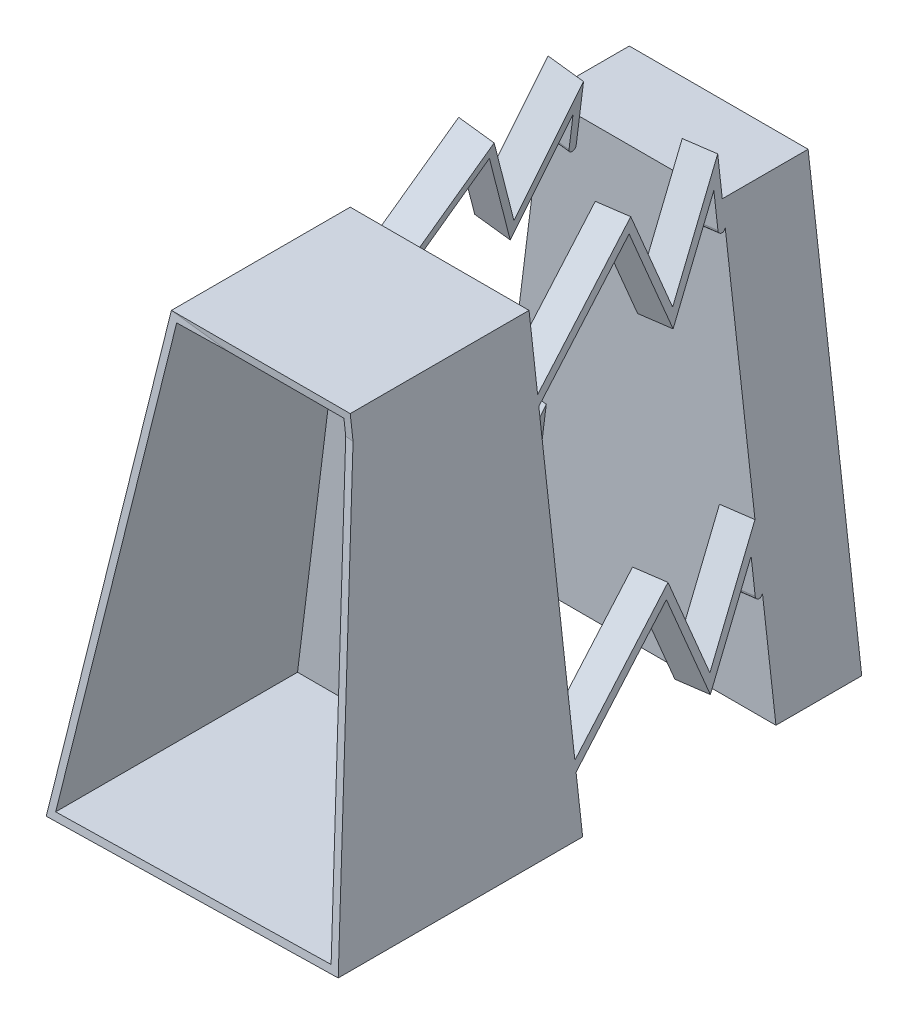
from build123d import *

# Parameters (mm, degrees)
BOSS_EXTRUDE1_DEPTH = 350
SHELL1_T            = -10
CUT_EXTRUDE1_DEPTH  = 436
SKETCH3_W           = 259.761046689
SKETCH3_H           = 96.41009556
CUT_EXTRUDE2_DEPTH  = 653.147409369
BOSS_EXTRUDE2_DEPTH = 50
BOSS_EXTRUDE3_DEPTH = 120
CUT_EXTRUDE3_DEPTH  = 110


with BuildPart() as part:
    # Sketch1 → Boss-Extrude1 (new body)
    with BuildSketch(Plane.XY):
        Polygon((-125, 424.335548173), (125, 424.335548173), (200, -175.664451827), (-200, -175.664451827), align=None)
    extrude(amount=BOSS_EXTRUDE1_DEPTH)

    # Shell1
    shell1_openings = [part.faces().sort_by_distance(p)[0] for p in [
        (0, 101.258625096, 350),
    ]]
    offset(amount=SHELL1_T, openings=shell1_openings, kind=Kind.INTERSECTION)

    # Sketch2 → Cut-Extrude1 (cut)
    with BuildSketch(Plane(origin=(-175.302836698, 21.912854587, 0), x_dir=(0, 0, 1), z_dir=(-0.9922778767136677, 0.12403473458920852, 0))):
        Polygon((250, 405.554434931), (350, -199.114896191), (350, 405.554434931), align=None)
    extrude(amount=-CUT_EXTRUDE1_DEPTH, mode=Mode.SUBTRACT)

    # Sketch3 → Cut-Extrude2 (cut, through all)
    with BuildSketch(Plane(origin=(-175.302836698, 21.912854587, 0), x_dir=(0, 0, 1), z_dir=(-0.9922778767136677, 0.12403473458920852, 0))):
        with Locations((379.880523345, 453.759482711)):
            Rectangle(SKETCH3_W, SKETCH3_H)
    extrude(amount=-CUT_EXTRUDE2_DEPTH, mode=Mode.SUBTRACT)

    # Sketch5 → Boss-Extrude2 (add)
    with BuildSketch(Plane(origin=(-175.302836698, 21.912854587, 0), x_dir=(0, 0, 1), z_dir=(-0.9922778767136677, 0.12403473458920852, 0))):
        with BuildLine():
            Line((0, -124.744929756), (-142.467162168, 5.816018008))
            Line((-142.467162168, 5.816018008), (-187.751575152, -124.744929756))
            Line((-187.751575152, -124.744929756), (-260.206635925, 0))
            Line((-260.206635925, 0), (-260.206635925, -46.209963839))
            ThreePointArc((-260.206635925, -46.209963839), (-265.206635925, -51.209963839), (-270.206635925, -46.209963839))
            Line((-270.206635925, -46.209963839), (-270.206635925, 37.127182563))
            Line((-270.206635925, 37.127182563), (-190.054813406, -100.869161145))
            Line((-190.054813406, -100.869161145), (-146.928792702, 23.468856407))
            Line((-146.928792702, 23.468856407), (6.756291537, -117.372513282))
            ThreePointArc((6.756291537, -117.372513282), (7.064354006, -124.436867288), (0, -124.744929756))
        make_face()
        with BuildLine():
            Line((0, 295.255070244), (-142.467162168, 425.816018008))
            Line((-142.467162168, 425.816018008), (-187.751575152, 295.255070244))
            Line((-187.751575152, 295.255070244), (-260.206635925, 420))
            Line((-260.206635925, 420), (-260.206635925, 373.790036161))
            ThreePointArc((-260.206635925, 373.790036161), (-265.206635925, 368.790036161), (-270.206635925, 373.790036161))
            Line((-270.206635925, 373.790036161), (-270.206635925, 457.127182563))
            Line((-270.206635925, 457.127182563), (-190.054813406, 319.130838855))
            Line((-190.054813406, 319.130838855), (-146.928792702, 443.468856407))
            Line((-146.928792702, 443.468856407), (6.756291537, 302.627486718))
            ThreePointArc((6.756291537, 302.627486718), (7.064354006, 295.563132712), (0, 295.255070244))
        make_face()
    boss_extrude2 = extrude(amount=-BOSS_EXTRUDE2_DEPTH)

    # Mirror1: Boss-Extrude2 across plane
    add(boss_extrude2.mirror(Plane(origin=(0, 0, 0), x_dir=(0, 0, 1), z_dir=(1, 0, 0))))

    # Sketch6 → Boss-Extrude3 (add)
    with BuildSketch(Plane(origin=(0, 0, -270.206635925), x_dir=(-1, 0, 0), z_dir=(0, 0, -1))):
        Polygon((-200, -175.664451827), (-125, 424.335548173), (125, 424.335548173), (200, -175.664451827), align=None)
    extrude(amount=BOSS_EXTRUDE3_DEPTH)

    # Sketch7 → Cut-Extrude3 (cut)
    with BuildSketch(Plane(origin=(0, 0, -390.206635925), x_dir=(-1, 0, 0), z_dir=(0, 0, -1))):
        Polygon((-192.972753686, -170.052955611), (-114.88610452, 414.250591596), (113.988556829, 414.250591596), (190.280110611, -170.052955611), align=None)
    extrude(amount=-CUT_EXTRUDE3_DEPTH, mode=Mode.SUBTRACT)


solid = part.part
